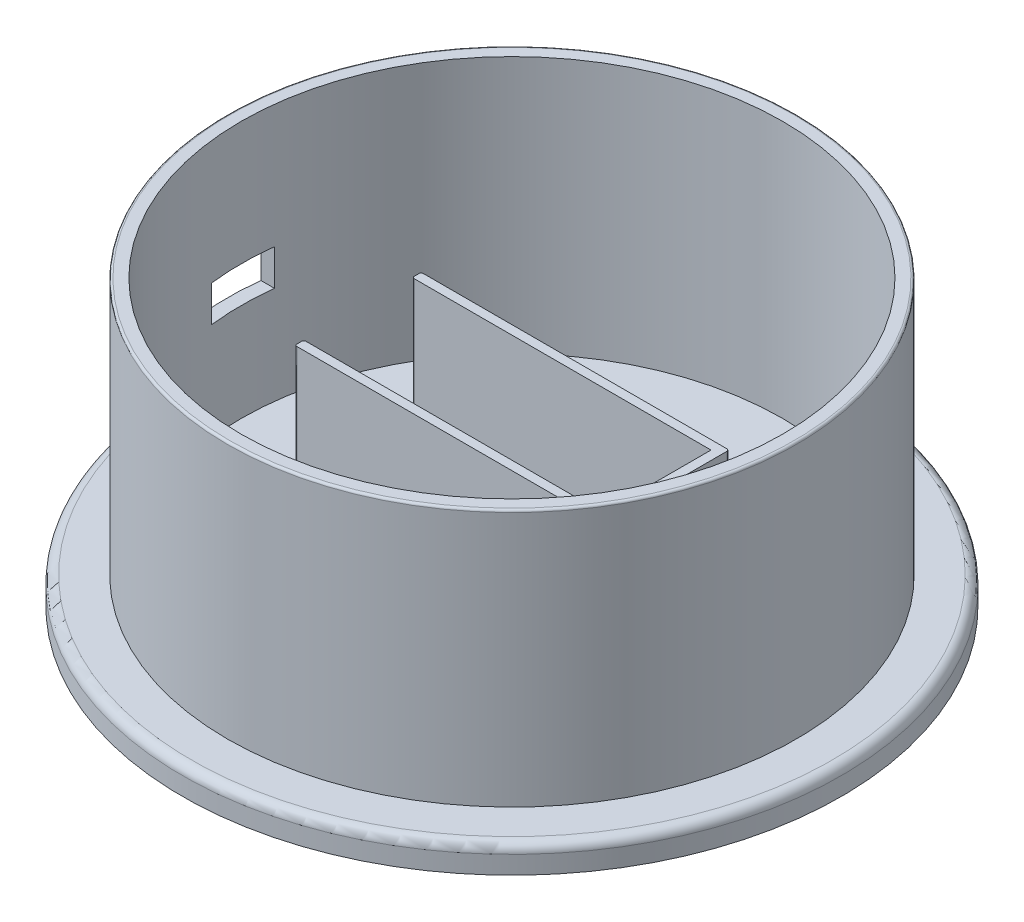
from build123d import *

# Parameters (mm, degrees)
SKETCH1_R           = 31.5
SKETCH1_R_2         = 30
BOSS_EXTRUDE1_DEPTH = 28.5
SKETCH2_R           = 36.5
BOSS_EXTRUDE2_DEPTH = 3
BOSS_EXTRUDE3_DEPTH = 17
SKETCH4_W           = 7
SKETCH4_H           = 4
CUT_EXTRUDE1_DEPTH  = 71.042861878
FILLET1_R           = 1
FILLET2_R           = 0.25
FILLET3_R           = 0.25


with BuildPart() as part:
    # Sketch1 → Boss-Extrude1 (new body)
    with BuildSketch(Plane(origin=(0, 0, 0), x_dir=(1, 0, 0), z_dir=(0, 1, 0))):
        with Locations(Location((0, 0, 0), (0, 0, 90))):
            Circle(SKETCH1_R)
        with Locations(Location((0, 0, 0), (0, 0, 90))):
            Circle(SKETCH1_R_2, mode=Mode.SUBTRACT)
    extrude(amount=BOSS_EXTRUDE1_DEPTH)

    # Sketch2 → Boss-Extrude2 (add)
    with BuildSketch(Plane.XZ):
        with Locations(Location((0, 0, 0), (0, 0, 270))):
            Circle(SKETCH2_R)
    extrude(amount=BOSS_EXTRUDE2_DEPTH)

    # Sketch3 → Boss-Extrude3 (add)
    with BuildSketch(Plane(origin=(0, 0, 0), x_dir=(1, 0, 0), z_dir=(0, 1, 0))):
        Polygon((-16.05, 6), (-17.05, 6), (-17.05, 7), (17.05, 7), (17.05, -7), (-17.05, -7), (-17.05, -6), (-16.05, -6), (16.05, -6), (16.05, 6), align=None)
    extrude(amount=BOSS_EXTRUDE3_DEPTH)

    # Sketch4 → Cut-Extrude1 (cut, through all)
    with BuildSketch(Plane.ZY.offset(-16.05)):
        with Locations((0, 12.835709784)):
            Rectangle(SKETCH4_W, SKETCH4_H)
    extrude(amount=CUT_EXTRUDE1_DEPTH, mode=Mode.SUBTRACT)

    # Fillet1
    fillet1_edges = [part.edges().sort_by_distance(p)[0] for p in [
        (0, 0, 36.5),
    ]]
    fillet(fillet1_edges, radius=FILLET1_R)

    # Fillet2
    fillet2_edges = [part.edges().sort_by_distance(p)[0] for p in [
        (0, 28.5, 31.5),
    ]]
    fillet(fillet2_edges, radius=FILLET2_R)

    # Fillet3
    fillet3_edges = [part.edges().sort_by_distance(p)[0] for p in [
        (-17.05, 8.5, 6),
        (-17.05, 8.5, 7),
        (17.05, 8.5, 7),
        (17.05, 8.5, -7),
        (-17.05, 8.5, -7),
        (-17.05, 8.5, -6),
    ]]
    fillet(fillet3_edges, radius=FILLET3_R)


solid = part.part
